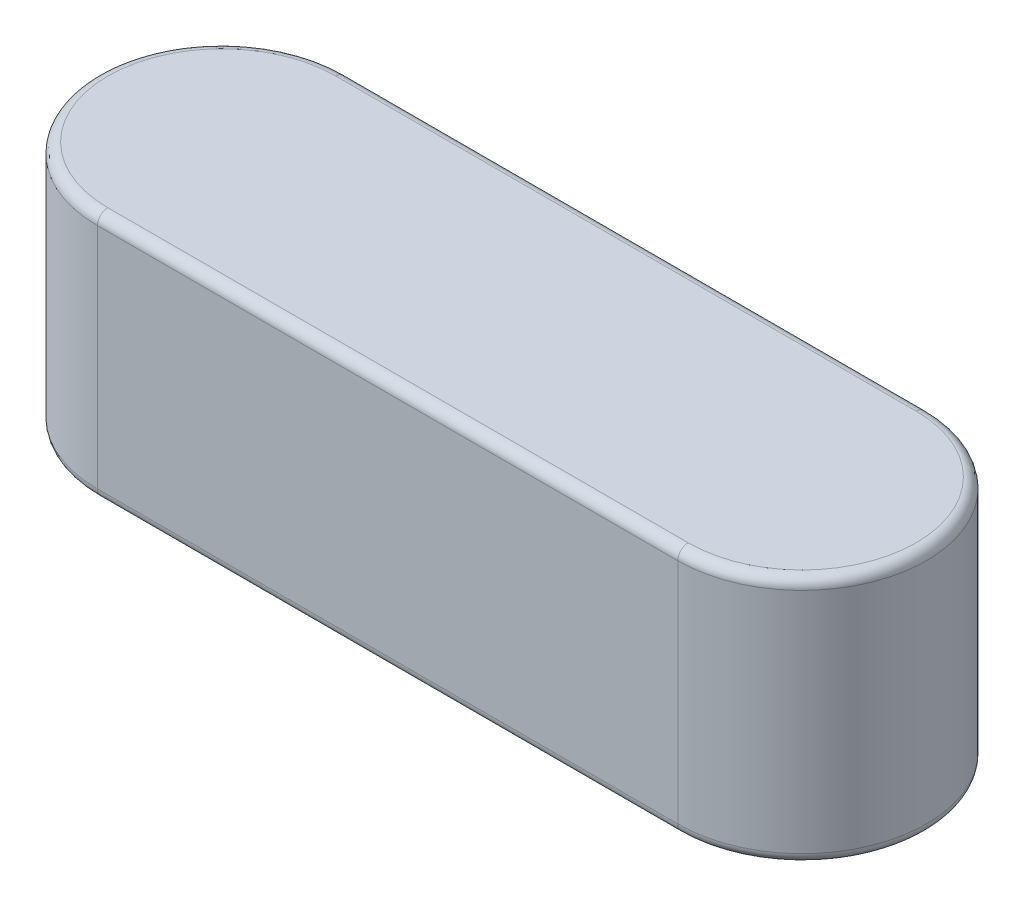
from build123d import *

# Parameters (mm, degrees)
EXTRUDE1_DEPTH = 6
FILLET1_R      = 0.25


with BuildPart() as part:
    # Sketch1 → Extrude1 (new body)
    with BuildSketch(Plane(origin=(0, 0, 0), x_dir=(1, 0, 0), z_dir=(0, 1, 0))):
        with BuildLine():
            Line((-14, 3), (0, 3))
            ThreePointArc((0, 3), (3, 0), (0, -3))
            Line((0, -3), (-14, -3))
            ThreePointArc((-14, -3), (-17, 0), (-14, 3))
        make_face()
    extrude(amount=EXTRUDE1_DEPTH)

    # Fillet1
    fillet1_edges = [part.edges().sort_by_distance(p)[0] for p in [
        (3, 6, 0),
        (-7, 6, -3),
        (-17, 6, 0),
        (-7, 0, -3),
        (3, 0, 0),
        (-7, 0, 3),
        (-17, 0, 0),
        (-7, 6, 3),
    ]]
    fillet(fillet1_edges, radius=FILLET1_R)


solid = part.part
